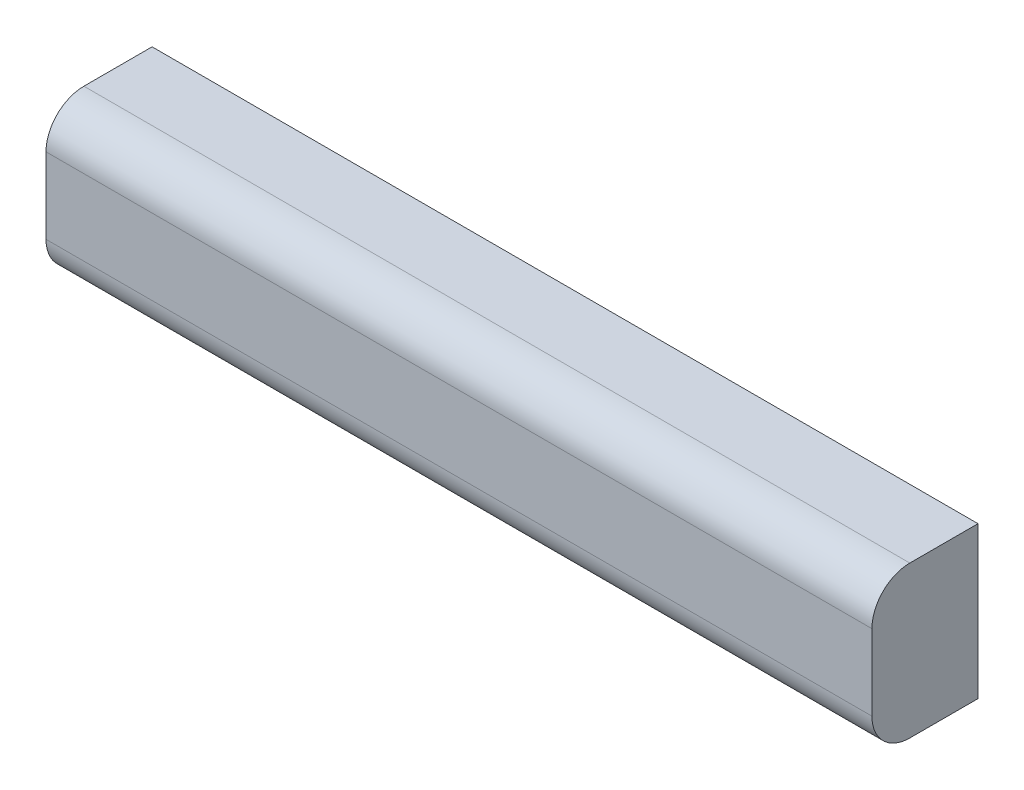
from build123d import *

# Parameters (mm, degrees)
SKETCH1_W           = 692.15
SKETCH1_H           = 127
BOSS_EXTRUDE1_DEPTH = 44.45
FILLET1_R           = 31.75
SKETCH2_R           = 4.7625
CUT_EXTRUDE1_DEPTH  = 25.4


with BuildPart() as part:
    # Sketch1 → Boss-Extrude1 (new, symmetric)
    with BuildSketch(Plane.XY):
        Rectangle(SKETCH1_W, SKETCH1_H)
    extrude(amount=BOSS_EXTRUDE1_DEPTH, both=True)

    # Fillet1
    fillet1_edges = [part.edges().sort_by_distance(p)[0] for p in [
        (0, -63.5, 44.45),
        (0, 63.5, 44.45),
    ]]
    fillet(fillet1_edges, radius=FILLET1_R)

    # Sketch2 → Cut-Extrude1 (cut)
    with BuildSketch(Plane(origin=(0, 0, -44.45), x_dir=(-1, 0, 0), z_dir=(0, 0, -1))):
        with Locations(Location((157.967933997, 0, 0), (0, 0, 180))):
            Circle(SKETCH2_R)
        with Locations(Location((183.367933997, 0, 0), (0, 0, 180))):
            Circle(SKETCH2_R)
        with Locations((12.7, 0)):
            Circle(SKETCH2_R)
        with Locations((-12.7, 0)):
            Circle(SKETCH2_R)
        with Locations((-157.967933997, 0)):
            Circle(SKETCH2_R)
        with Locations((-183.367933997, 0)):
            Circle(SKETCH2_R)
    extrude(amount=-CUT_EXTRUDE1_DEPTH, mode=Mode.SUBTRACT)


solid = part.part
